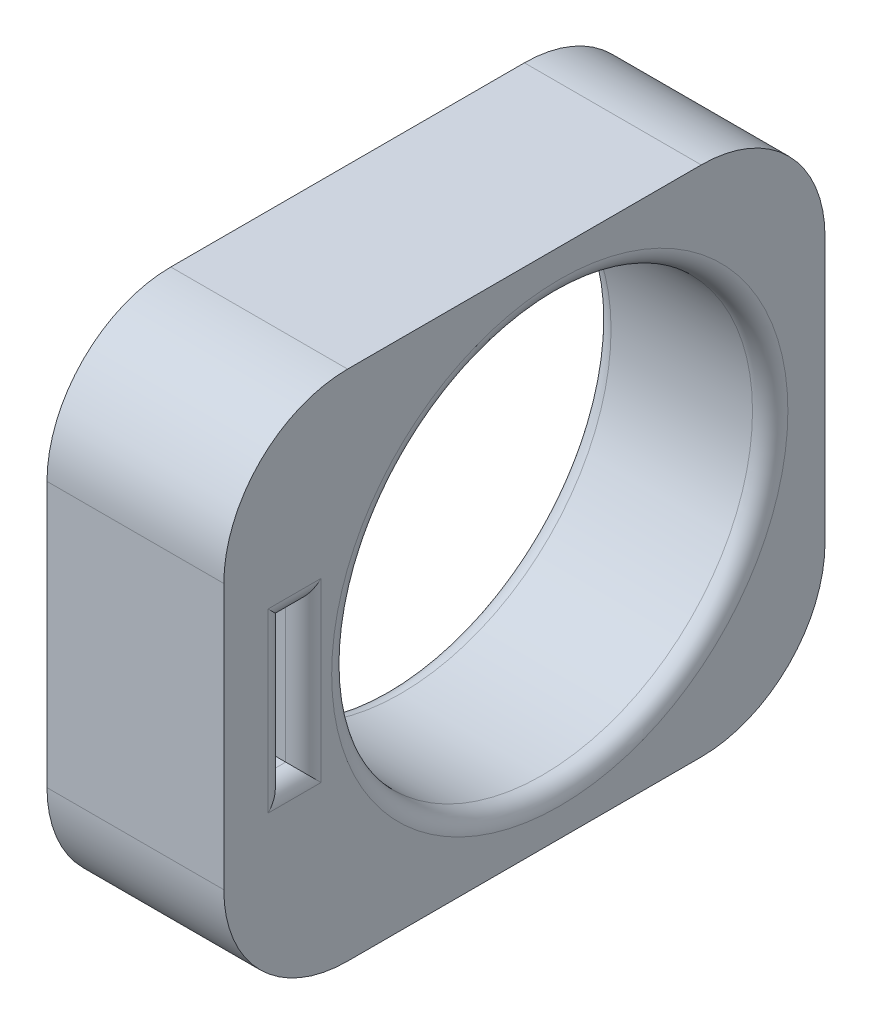
from build123d import *

# Parameters (mm, degrees)
SKETCH1_W               = 10
SKETCH1_H               = 29
BOSS_EXTRUDE1_DEPTH     = 34
CUT_EXTRUDE1_DEPTH      = 45.55333882
CUT_EXTRUDE1_DEPTH_BACK = 45.55333882
SKETCH2_R               = 11.9
FILLET1_R               = 1
FILLET2_R               = 7
CUT_EXTRUDE2_DEPTH      = 45.55333882
CUT_EXTRUDE2_DEPTH_BACK = 45.55333882
FILLET3_R               = 1
FILLET4_R               = 1
FILLET5_R               = 7


with BuildPart() as part:
    # Sketch1 → Boss-Extrude1 (new body)
    with BuildSketch(Plane.XY):
        with Locations((5, 12.5)):
            Rectangle(SKETCH1_W, SKETCH1_H)
    extrude(amount=BOSS_EXTRUDE1_DEPTH)

    # Sketch2 → Cut-Extrude1 (cut, two sides: drawn at the far end of the back side and taken through both)
    with BuildSketch(Plane(origin=(10, 0, 0), x_dir=(0, 0, -1), z_dir=(1, 0, 0)).offset(-CUT_EXTRUDE1_DEPTH_BACK)):
        with Locations((-15, 12.5)):
            Circle(SKETCH2_R)
    extrude(amount=CUT_EXTRUDE1_DEPTH + CUT_EXTRUDE1_DEPTH_BACK, mode=Mode.SUBTRACT)

    # Fillet1
    fillet1_edges = [part.edges().sort_by_distance(p)[0] for p in [
        (10, 12.5, 26.9),
        (0, 12.5, 26.9),
    ]]
    fillet(fillet1_edges, radius=FILLET1_R)

    # Fillet2
    fillet2_edges = [part.edges().sort_by_distance(p)[0] for p in [
        (5, 27, 0),
        (5, -2, 0),
    ]]
    fillet(fillet2_edges, radius=FILLET2_R)

    # Sketch3 → Cut-Extrude2 (cut, two sides: drawn at the far end of the back side and taken through both)
    with BuildSketch(Plane(origin=(10, 0, 0), x_dir=(0, 0, -1), z_dir=(1, 0, 0)).offset(-CUT_EXTRUDE2_DEPTH_BACK)):
        Polygon((-29.5, 12.5), (-29.5, 16.5), (-30.5, 16.5), (-30.5, 8.5), (-29.5, 8.5), align=None)
    extrude(amount=CUT_EXTRUDE2_DEPTH + CUT_EXTRUDE2_DEPTH_BACK, mode=Mode.SUBTRACT)

    # Fillet3
    fillet3_edges = [part.edges().sort_by_distance(p)[0] for p in [
        (0, 16.5, 30),
        (0, 12.5, 30.5),
        (0, 8.5, 30),
        (0, 12.5, 29.5),
    ]]
    fillet(fillet3_edges, radius=FILLET3_R)

    # Fillet4
    fillet4_edges = [part.edges().sort_by_distance(p)[0] for p in [
        (10, 8.5, 30),
        (10, 12.5, 30.5),
        (10, 16.5, 30),
        (10, 12.5, 29.5),
    ]]
    fillet(fillet4_edges, radius=FILLET4_R)

    # Fillet5
    fillet5_edges = [part.edges().sort_by_distance(p)[0] for p in [
        (5, -2, 34),
        (5, 27, 34),
    ]]
    fillet(fillet5_edges, radius=FILLET5_R)


solid = part.part
